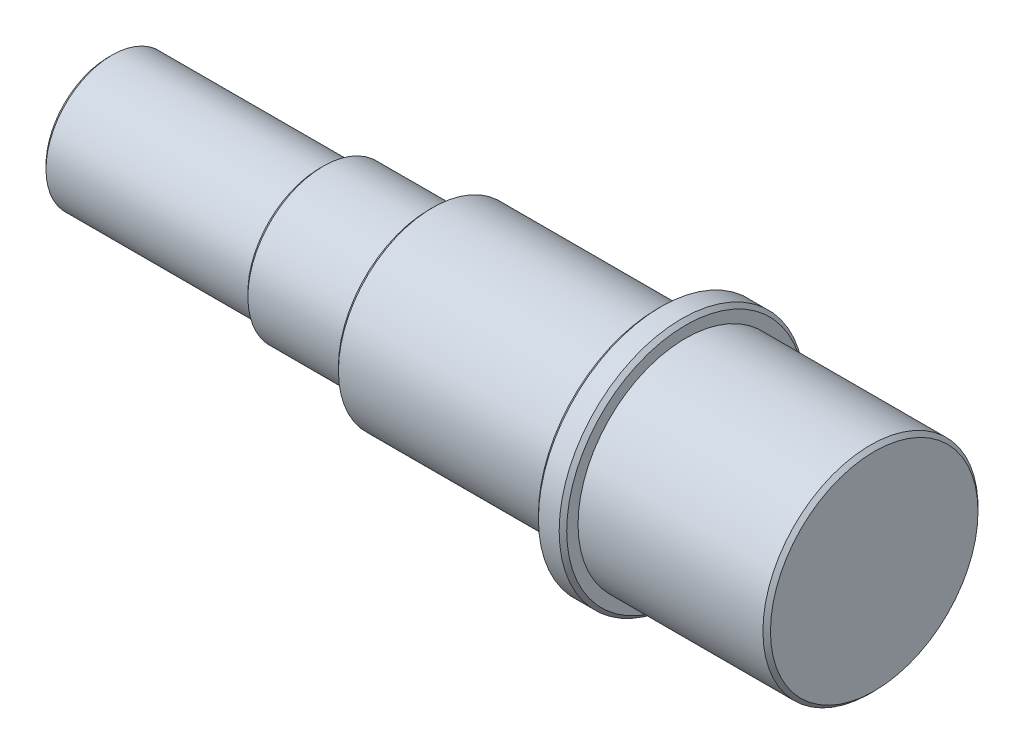
from build123d import *

# Parameters (mm, degrees)
CHAMFER_1_SIZE      = 1
CUT_EXTRUDE_START   = -17.5
CUT_EXTRUDE_1_DEPTH = 5


with BuildPart() as part:
    # Эскиз1 → Повернуть1 (revolve)
    with BuildSketch(Plane.XY, mode=Mode.PRIVATE) as revolve_1_sk:
        Polygon((0, 0), (0, 17.5), (56, 17.5), (56, 20), (85, 20), (85, 25), (145.5, 25), (145.5, 32.5), (153, 32.5), (153, 28.5), (203, 28.5), (203, 0), align=None)
    revolve(revolve_1_sk.sketch.rotate(Axis((0, 0, 0), (1, 0, 0)), 90), axis=Axis((0, 0, 0), (1, 0, 0)))

    # Фаска1
    chamfer_1_edges = [part.edges().sort_by_distance(p)[0] for p in [
        (153, 0, -32.5),
        (145.5, 0, -32.5),
        (85, 0, -25),
        (56, 0, -20),
        (0, 0, -17.5),
        (203, 0, -28.5),
    ]]
    chamfer(chamfer_1_edges, length=CHAMFER_1_SIZE)

    # Эскиз2 → Вырез-Вытянуть1 (cut)
    with BuildSketch(Plane.XY.offset(CUT_EXTRUDE_START)):
        with BuildLine():
            Line((7, 5), (47, 5))
            ThreePointArc((47, 5), (52, 0), (47, -5))
            Line((47, -5), (7, -5))
            ThreePointArc((7, -5), (2, 0), (7, 5))
        make_face()
    extrude(amount=CUT_EXTRUDE_1_DEPTH, mode=Mode.SUBTRACT)


solid = part.part
